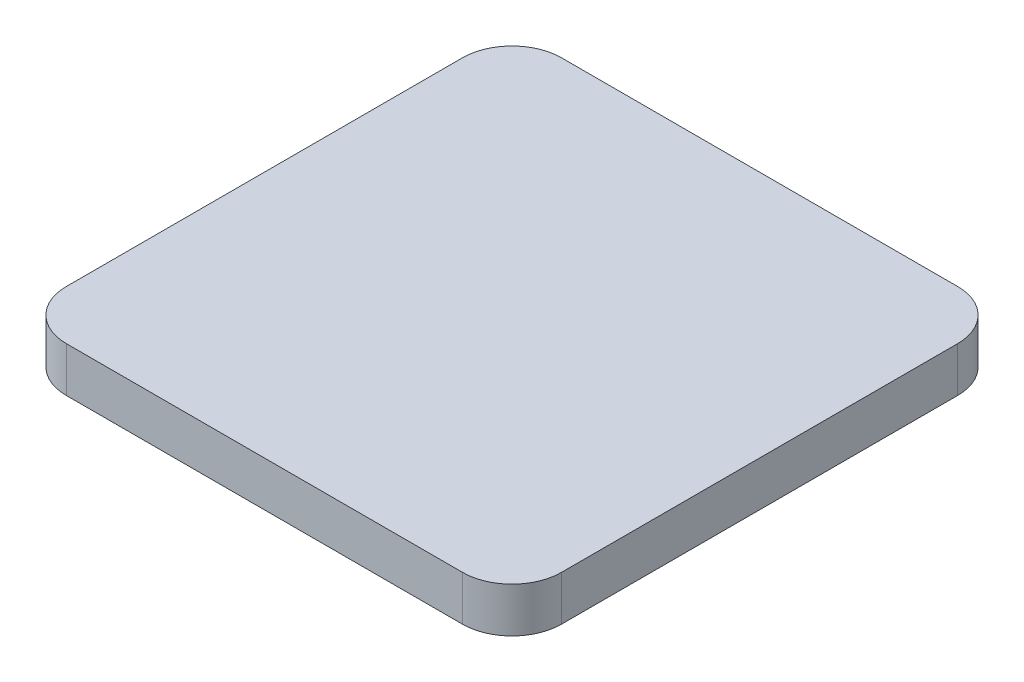
from build123d import *

# Parameters (mm, degrees)
SKETCH1_W           = 70
SKETCH1_H           = 70
BOSS_EXTRUDE1_DEPTH = 6.35
FILLET1_R           = 7


with BuildPart() as part:
    # Sketch1 → Boss-Extrude1 (new body)
    with BuildSketch(Plane(origin=(0, 0, 0), x_dir=(1, 0, 0), z_dir=(0, 1, 0))):
        with Locations((35, 35)):
            Rectangle(SKETCH1_W, SKETCH1_H)
    extrude(amount=BOSS_EXTRUDE1_DEPTH)

    # Fillet1
    fillet1_edges = [part.edges().sort_by_distance(p)[0] for p in [
        (0, 3.175, -70),
        (70, 3.175, -70),
        (70, 3.175, 0),
        (0, 3.175, 0),
    ]]
    fillet(fillet1_edges, radius=FILLET1_R)


solid = part.part
